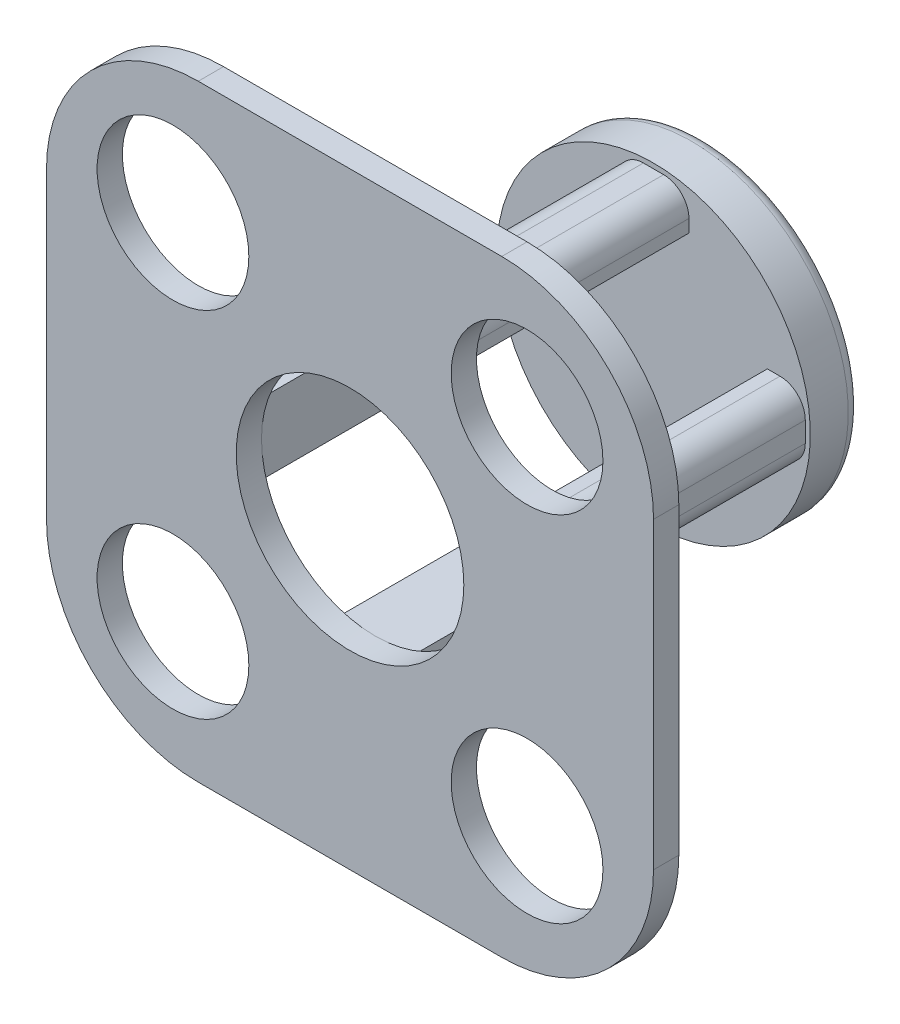
from build123d import *

# Parameters (mm, degrees)
SKETCH2_R           = 3
BOSS_EXTRUDE2_DEPTH = 1
SKETCH6_W           = 2.8
SKETCH6_H           = 1.5
SKETCH6_W_2         = 1.5
SKETCH6_H_2         = 2.8
BOSS_EXTRUDE5_DEPTH = 11
FILLET4_R           = 1
SKETCH8_R           = 4.5
CUT_EXTRUDE1_DEPTH  = 20
SKETCH9_R           = 6.2
BOSS_EXTRUDE6_DEPTH = 2
FILLET5_R           = 0.5


with BuildPart() as part:
    # Sketch2 → Boss-Extrude2 (new body)
    with BuildSketch(Plane.XY):
        with BuildLine():
            Line((12, -6), (12, 0))
            Line((12, 0), (12, 6))
            ThreePointArc((12, 6), (10.242640687, 10.242640687), (6, 12))
            Line((6, 12), (0, 12))
            Line((0, 12), (-6, 12))
            ThreePointArc((-6, 12), (-10.242640687, 10.242640687), (-12, 6))
            Line((-12, 6), (-12, 0))
            Line((-12, 0), (-12, -6))
            ThreePointArc((-12, -6), (-10.242640687, -10.242640687), (-6, -12))
            Line((-6, -12), (0, -12))
            Line((0, -12), (6, -12))
            ThreePointArc((6, -12), (10.242640687, -10.242640687), (12, -6))
        make_face()
        with Locations((-7, -7)):
            Circle(SKETCH2_R, mode=Mode.SUBTRACT)
        with Locations((7, -7)):
            Circle(SKETCH2_R, mode=Mode.SUBTRACT)
        with Locations((-7, 7)):
            Circle(SKETCH2_R, mode=Mode.SUBTRACT)
        Circle(SKETCH2_R, mode=Mode.SUBTRACT)
        with Locations((7, 7)):
            Circle(SKETCH2_R, mode=Mode.SUBTRACT)
    extrude(amount=BOSS_EXTRUDE2_DEPTH)

    # Sketch6 → Boss-Extrude5 (add)
    with BuildSketch(Plane(origin=(0, 0, 0), x_dir=(-1, 0, 0), z_dir=(0, 0, -1))):
        with Locations((0, 5.25)):
            Rectangle(SKETCH6_W, SKETCH6_H)
        with Locations((-5.25, 0)):
            Rectangle(SKETCH6_W_2, SKETCH6_H_2)
        with Locations((0, -5.25)):
            Rectangle(SKETCH6_W, SKETCH6_H)
        with Locations((5.25, 0)):
            Rectangle(SKETCH6_W_2, SKETCH6_H_2)
    extrude(amount=BOSS_EXTRUDE5_DEPTH)

    # Fillet4
    fillet4_edges = [part.edges().sort_by_distance(p)[0] for p in [
        (-6, -1.4, -5.5),
        (-6, 1.4, -5.5),
        (-1.4, -6, -5.5),
        (1.4, -6, -5.5),
        (6, -1.4, -5.5),
        (6, 1.4, -5.5),
        (-1.4, 6, -5.5),
        (1.4, 6, -5.5),
    ]]
    fillet(fillet4_edges, radius=FILLET4_R)

    # Sketch8 → Cut-Extrude1 (cut)
    with BuildSketch(Plane(origin=(0, 0, -11), x_dir=(-1, 0, 0), z_dir=(0, 0, -1))):
        Circle(SKETCH8_R)
    extrude(amount=-CUT_EXTRUDE1_DEPTH, mode=Mode.SUBTRACT)

    # Sketch9 → Boss-Extrude6 (add)
    with BuildSketch(Plane(origin=(0, 0, -11), x_dir=(-1, 0, 0), z_dir=(0, 0, -1))):
        Circle(SKETCH9_R)
    extrude(amount=BOSS_EXTRUDE6_DEPTH)

    # Fillet5
    fillet5_edges = [part.edges().sort_by_distance(p)[0] for p in [
        (6.2, 0, -13),
    ]]
    fillet(fillet5_edges, radius=FILLET5_R)


solid = part.part
